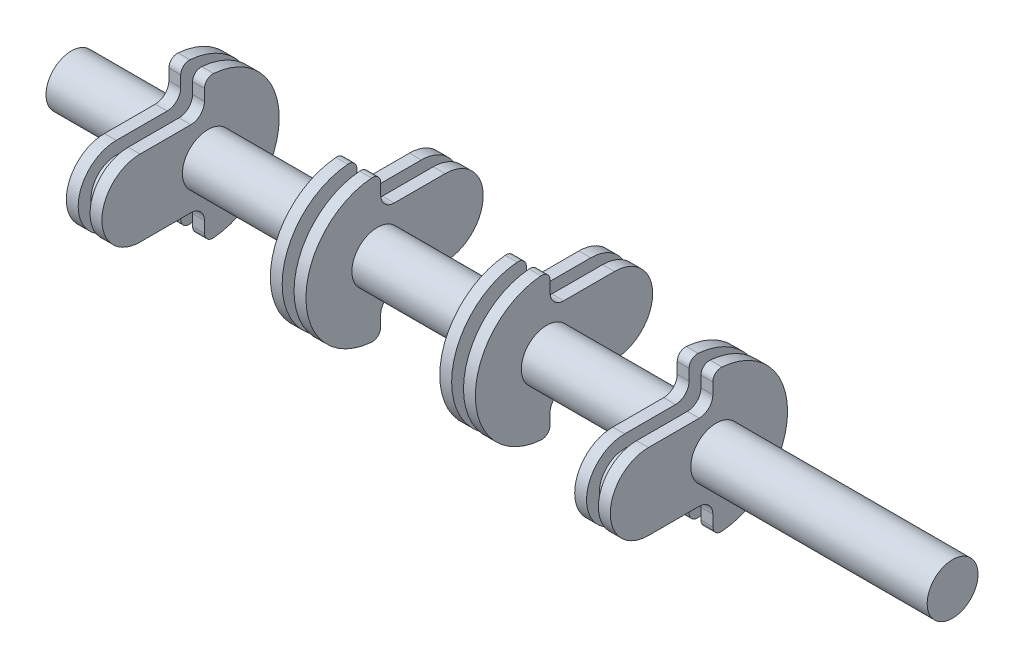
from build123d import *

# Parameters (mm, degrees)
SKETCH1_R               = 15
BOSS_EXTRUDE1_DEPTH     = 400
BOSS_EXTRUDE2_START     = 53.5
BOSS_EXTRUDE2_DEPTH     = 7
BOSS_EXTRUDE3_START     = 39.5
BOSS_EXTRUDE3_DEPTH     = 7
BOSS_EXTRUDE4_START     = 339.5
BOSS_EXTRUDE4_DEPTH     = 7
BOSS_EXTRUDE5_START     = 353.5
BOSS_EXTRUDE5_DEPTH     = 7
CUT_EXTRUDE1_DEPTH      = 60
CUT_EXTRUDE1_DEPTH_BACK = 31
SKETCH5_W               = 7
SKETCH5_H               = 34.934316099
SKETCH5_H_2             = 32.180943616
BOSS_EXTRUDE6_START     = 46.5
SKETCH2_8_R             = 15
BOSS_EXTRUDE6_DEPTH     = 7
BOSS_EXTRUDE7_START     = 346.5
SKETCH2_9_R             = 15
BOSS_EXTRUDE7_DEPTH     = 7
BOSS_EXTRUDE8_START     = 139.5
BOSS_EXTRUDE8_DEPTH     = 7
BOSS_EXTRUDE9_START     = 153.5
BOSS_EXTRUDE9_DEPTH     = 7
BOSS_EXTRUDE10_START    = 239.5
BOSS_EXTRUDE10_DEPTH    = 7
BOSS_EXTRUDE11_START    = 253.5
BOSS_EXTRUDE11_DEPTH    = 7
CUT_EXTRUDE3_DEPTH      = 33
CUT_EXTRUDE3_DEPTH_BACK = 33
SKETCH8_W               = 7
SKETCH8_H               = 30
BOSS_EXTRUDE12_START    = 146.5
SKETCH6_6_R             = 15
BOSS_EXTRUDE12_DEPTH    = 7
BOSS_EXTRUDE13_START    = 246.5
SKETCH6_7_R             = 15
BOSS_EXTRUDE13_DEPTH    = 7
SKETCH9_R               = 15
BOSS_EXTRUDE14_DEPTH    = 100
SKETCH10_R              = 15
BOSS_EXTRUDE15_DEPTH    = 20


with BuildPart() as part:
    # Sketch1 → Boss-Extrude1 (new body)
    with BuildSketch(Plane(origin=(0, 0, 0), x_dir=(0, 0, -1), z_dir=(1, 0, 0))):
        Circle(SKETCH1_R)
    extrude(amount=BOSS_EXTRUDE1_DEPTH)

    # Sketch2 → Boss-Extrude2 (add)
    with BuildSketch(Plane.ZY.offset(-400).offset(BOSS_EXTRUDE2_START)):
        with BuildLine():
            Line((2, 30.5), (2, 37))
            ThreePointArc((2, 37), (0.389660992, 40.675622173), (-3.404079344, 41.983645241))
            ThreePointArc((-3.404079344, 41.983645241), (-42.121422387, 0), (-3.404079344, -41.983645241))
            ThreePointArc((-3.404079344, -41.983645241), (0.389660992, -40.675622173), (2, -37))
            Line((2, -37), (2, -30.5))
            ThreePointArc((2, -30.5), (4.343145751, -24.843145751), (10, -22.5))
            Line((10, -22.5), (40, -22.5))
            ThreePointArc((40, -22.5), (62.5, 0), (40, 22.5))
            Line((40, 22.5), (10, 22.5))
            ThreePointArc((10, 22.5), (4.343145751, 24.843145751), (2, 30.5))
        make_face()
    extrude(amount=BOSS_EXTRUDE2_DEPTH)

    # Sketch2<3> → Boss-Extrude3 (add)
    with BuildSketch(Plane.ZY.offset(-400).offset(BOSS_EXTRUDE3_START)):
        with BuildLine():
            Line((2, 30.5), (2, 37))
            ThreePointArc((2, 37), (0.389660992, 40.675622173), (-3.404079344, 41.983645241))
            ThreePointArc((-3.404079344, 41.983645241), (-42.121422387, 0), (-3.404079344, -41.983645241))
            ThreePointArc((-3.404079344, -41.983645241), (0.389660992, -40.675622173), (2, -37))
            Line((2, -37), (2, -30.5))
            ThreePointArc((2, -30.5), (4.343145751, -24.843145751), (10, -22.5))
            Line((10, -22.5), (40, -22.5))
            ThreePointArc((40, -22.5), (62.5, 0), (40, 22.5))
            Line((40, 22.5), (10, 22.5))
            ThreePointArc((10, 22.5), (4.343145751, 24.843145751), (2, 30.5))
        make_face()
    extrude(amount=BOSS_EXTRUDE3_DEPTH)

    # Sketch2<5> → Boss-Extrude4 (add)
    with BuildSketch(Plane.ZY.offset(-400).offset(BOSS_EXTRUDE4_START)):
        with BuildLine():
            Line((2, 30.5), (2, 37))
            ThreePointArc((2, 37), (0.389660992, 40.675622173), (-3.404079344, 41.983645241))
            ThreePointArc((-3.404079344, 41.983645241), (-42.121422387, 0), (-3.404079344, -41.983645241))
            ThreePointArc((-3.404079344, -41.983645241), (0.389660992, -40.675622173), (2, -37))
            Line((2, -37), (2, -30.5))
            ThreePointArc((2, -30.5), (4.343145751, -24.843145751), (10, -22.5))
            Line((10, -22.5), (40, -22.5))
            ThreePointArc((40, -22.5), (62.5, 0), (40, 22.5))
            Line((40, 22.5), (10, 22.5))
            ThreePointArc((10, 22.5), (4.343145751, 24.843145751), (2, 30.5))
        make_face()
    extrude(amount=BOSS_EXTRUDE4_DEPTH)

    # Sketch2<6> → Boss-Extrude5 (add)
    with BuildSketch(Plane.ZY.offset(-400).offset(BOSS_EXTRUDE5_START)):
        with BuildLine():
            Line((2, 30.5), (2, 37))
            ThreePointArc((2, 37), (0.389660992, 40.675622173), (-3.404079344, 41.983645241))
            ThreePointArc((-3.404079344, 41.983645241), (-42.121422387, 0), (-3.404079344, -41.983645241))
            ThreePointArc((-3.404079344, -41.983645241), (0.389660992, -40.675622173), (2, -37))
            Line((2, -37), (2, -30.5))
            ThreePointArc((2, -30.5), (4.343145751, -24.843145751), (10, -22.5))
            Line((10, -22.5), (40, -22.5))
            ThreePointArc((40, -22.5), (62.5, 0), (40, 22.5))
            Line((40, 22.5), (10, 22.5))
            ThreePointArc((10, 22.5), (4.343145751, 24.843145751), (2, 30.5))
        make_face()
    extrude(amount=BOSS_EXTRUDE5_DEPTH)

    # Sketch5 → Cut-Extrude1 (cut, two sides: drawn at the far end of the back side and taken through both)
    with BuildSketch(Plane(origin=(0, 0, 0), x_dir=(1, 0, 0), z_dir=(0, 1, 0)).offset(-CUT_EXTRUDE1_DEPTH_BACK)):
        with Locations((350, 2.467158049)):
            Rectangle(SKETCH5_W, SKETCH5_H)
        with Locations((50, 1.090471808)):
            Rectangle(SKETCH5_W, SKETCH5_H_2)
    extrude(amount=CUT_EXTRUDE1_DEPTH + CUT_EXTRUDE1_DEPTH_BACK, mode=Mode.SUBTRACT)


with BuildPart() as cut_extrude1_piece_1:
    # of the separate pieces the step leaves, piece 1, a body of its own (cut_extrude1_pieces)
    add(part.part.solids().sort_by_distance((53.5, 41.983645241, -3.404079344))[0])



with BuildPart() as cut_extrude1_piece_2:
    # of the separate pieces the step leaves, piece 2, a body of its own (cut_extrude1_pieces)
    add(part.part.solids().sort_by_distance((0, 0, -15))[0])


with BuildPart() as cut_extrude1_piece_3:
    # of the separate pieces the step leaves, piece 3, a body of its own (cut_extrude1_pieces)
    add(part.part.solids().sort_by_distance((353.5, 41.983645241, -3.404079344))[0])


with BuildPart() as cut_extrude1_piece_1_1:
    add(cut_extrude1_piece_1.part)

    add(cut_extrude1_piece_3.part)  # Boss-Extrude6 merges Cut-Extrude1 piece 3
    # Sketch2<8> → Boss-Extrude6 (add)
    with BuildSketch(Plane.ZY.offset(-400).offset(BOSS_EXTRUDE6_START)):
        with Locations((40, 0)):
            Circle(SKETCH2_8_R)
    extrude(amount=BOSS_EXTRUDE6_DEPTH)


    add(cut_extrude1_piece_2.part)  # Boss-Extrude7 merges Cut-Extrude1 piece 2
    # Sketch2<9> → Boss-Extrude7 (add)
    with BuildSketch(Plane.ZY.offset(-400).offset(BOSS_EXTRUDE7_START)):
        with Locations((40, 0)):
            Circle(SKETCH2_9_R)
    extrude(amount=BOSS_EXTRUDE7_DEPTH)

    # Sketch6 → Boss-Extrude8 (add)
    with BuildSketch(Plane(origin=(0, 0, 0), x_dir=(0, 0, -1), z_dir=(1, 0, 0)).offset(BOSS_EXTRUDE8_START)):
        with BuildLine():
            Line((2, 30.5), (2, 37))
            ThreePointArc((2, 37), (0.389660992, 40.675622173), (-3.404079344, 41.983645241))
            ThreePointArc((-3.404079344, 41.983645241), (-42.121422387, 0), (-3.404079344, -41.983645241))
            ThreePointArc((-3.404079344, -41.983645241), (0.389660992, -40.675622173), (2, -37))
            Line((2, -37), (2, -30.5))
            ThreePointArc((2, -30.5), (4.343145751, -24.843145751), (10, -22.5))
            Line((10, -22.5), (40, -22.5))
            ThreePointArc((40, -22.5), (62.5, 0), (40, 22.5))
            Line((40, 22.5), (10, 22.5))
            ThreePointArc((10, 22.5), (4.343145751, 24.843145751), (2, 30.5))
        make_face()
    extrude(amount=BOSS_EXTRUDE8_DEPTH)

    # Sketch6<3> → Boss-Extrude9 (add)
    with BuildSketch(Plane(origin=(0, 0, 0), x_dir=(0, 0, -1), z_dir=(1, 0, 0)).offset(BOSS_EXTRUDE9_START)):
        with BuildLine():
            Line((2, 30.5), (2, 37))
            ThreePointArc((2, 37), (0.389660992, 40.675622173), (-3.404079344, 41.983645241))
            ThreePointArc((-3.404079344, 41.983645241), (-42.121422387, 0), (-3.404079344, -41.983645241))
            ThreePointArc((-3.404079344, -41.983645241), (0.389660992, -40.675622173), (2, -37))
            Line((2, -37), (2, -30.5))
            ThreePointArc((2, -30.5), (4.343145751, -24.843145751), (10, -22.5))
            Line((10, -22.5), (40, -22.5))
            ThreePointArc((40, -22.5), (62.5, 0), (40, 22.5))
            Line((40, 22.5), (10, 22.5))
            ThreePointArc((10, 22.5), (4.343145751, 24.843145751), (2, 30.5))
        make_face()
    extrude(amount=BOSS_EXTRUDE9_DEPTH)

    # Sketch6<4> → Boss-Extrude10 (add)
    with BuildSketch(Plane(origin=(0, 0, 0), x_dir=(0, 0, -1), z_dir=(1, 0, 0)).offset(BOSS_EXTRUDE10_START)):
        with BuildLine():
            Line((2, 30.5), (2, 37))
            ThreePointArc((2, 37), (0.389660992, 40.675622173), (-3.404079344, 41.983645241))
            ThreePointArc((-3.404079344, 41.983645241), (-42.121422387, 0), (-3.404079344, -41.983645241))
            ThreePointArc((-3.404079344, -41.983645241), (0.389660992, -40.675622173), (2, -37))
            Line((2, -37), (2, -30.5))
            ThreePointArc((2, -30.5), (4.343145751, -24.843145751), (10, -22.5))
            Line((10, -22.5), (40, -22.5))
            ThreePointArc((40, -22.5), (62.5, 0), (40, 22.5))
            Line((40, 22.5), (10, 22.5))
            ThreePointArc((10, 22.5), (4.343145751, 24.843145751), (2, 30.5))
        make_face()
    extrude(amount=BOSS_EXTRUDE10_DEPTH)

    # Sketch6<5> → Boss-Extrude11 (add)
    with BuildSketch(Plane(origin=(0, 0, 0), x_dir=(0, 0, -1), z_dir=(1, 0, 0)).offset(BOSS_EXTRUDE11_START)):
        with BuildLine():
            Line((2, 30.5), (2, 37))
            ThreePointArc((2, 37), (0.389660992, 40.675622173), (-3.404079344, 41.983645241))
            ThreePointArc((-3.404079344, 41.983645241), (-42.121422387, 0), (-3.404079344, -41.983645241))
            ThreePointArc((-3.404079344, -41.983645241), (0.389660992, -40.675622173), (2, -37))
            Line((2, -37), (2, -30.5))
            ThreePointArc((2, -30.5), (4.343145751, -24.843145751), (10, -22.5))
            Line((10, -22.5), (40, -22.5))
            ThreePointArc((40, -22.5), (62.5, 0), (40, 22.5))
            Line((40, 22.5), (10, 22.5))
            ThreePointArc((10, 22.5), (4.343145751, 24.843145751), (2, 30.5))
        make_face()
    extrude(amount=BOSS_EXTRUDE11_DEPTH)

    # Sketch8 → Cut-Extrude3 (cut, two sides: drawn at the far end of the back side and taken through both)
    with BuildSketch(Plane(origin=(0, 0, 0), x_dir=(1, 0, 0), z_dir=(0, 1, 0)).offset(-CUT_EXTRUDE3_DEPTH_BACK)):
        with Locations((150, 0)):
            Rectangle(SKETCH8_W, SKETCH8_H)
        with Locations((250, 0)):
            Rectangle(SKETCH8_W, SKETCH8_H)
    extrude(amount=CUT_EXTRUDE3_DEPTH + CUT_EXTRUDE3_DEPTH_BACK, mode=Mode.SUBTRACT)


with BuildPart() as cut_extrude3_piece_1:
    # of the separate pieces the step leaves, piece 1, a body of its own (cut_extrude3_pieces)
    add(cut_extrude1_piece_1_1.part.solids().sort_by_distance((0, 0, -15))[0])



with BuildPart() as cut_extrude3_piece_2:
    # of the separate pieces the step leaves, piece 2, a body of its own (cut_extrude3_pieces)
    add(cut_extrude1_piece_1_1.part.solids().sort_by_distance((253.5, 22.5, -10))[0])


with BuildPart() as cut_extrude3_piece_3:
    # of the separate pieces the step leaves, piece 3, a body of its own (cut_extrude3_pieces)
    add(cut_extrude1_piece_1_1.part.solids().sort_by_distance((153.5, 22.5, -10))[0])


with BuildPart() as cut_extrude3_piece_1_1:
    add(cut_extrude3_piece_1.part)

    add(cut_extrude3_piece_3.part)  # Boss-Extrude12 merges Cut-Extrude3 piece 3
    # Sketch6<6> → Boss-Extrude12 (add)
    with BuildSketch(Plane(origin=(0, 0, 0), x_dir=(0, 0, -1), z_dir=(1, 0, 0)).offset(BOSS_EXTRUDE12_START)):
        with Locations((40, 0)):
            Circle(SKETCH6_6_R)
    extrude(amount=BOSS_EXTRUDE12_DEPTH)


    add(cut_extrude3_piece_2.part)  # Boss-Extrude13 merges Cut-Extrude3 piece 2
    # Sketch6<7> → Boss-Extrude13 (add)
    with BuildSketch(Plane(origin=(0, 0, 0), x_dir=(0, 0, -1), z_dir=(1, 0, 0)).offset(BOSS_EXTRUDE13_START)):
        with Locations((40, 0)):
            Circle(SKETCH6_7_R)
    extrude(amount=BOSS_EXTRUDE13_DEPTH)

    # Sketch9 → Boss-Extrude14 (add)
    with BuildSketch(Plane(origin=(400, 0, 0), x_dir=(0, 0, -1), z_dir=(1, 0, 0))):
        Circle(SKETCH9_R)
    extrude(amount=BOSS_EXTRUDE14_DEPTH)

    # Sketch10 → Boss-Extrude15 (add)
    with BuildSketch(Plane.ZY):
        Circle(SKETCH10_R)
    extrude(amount=BOSS_EXTRUDE15_DEPTH)


solid = cut_extrude3_piece_1_1.part
